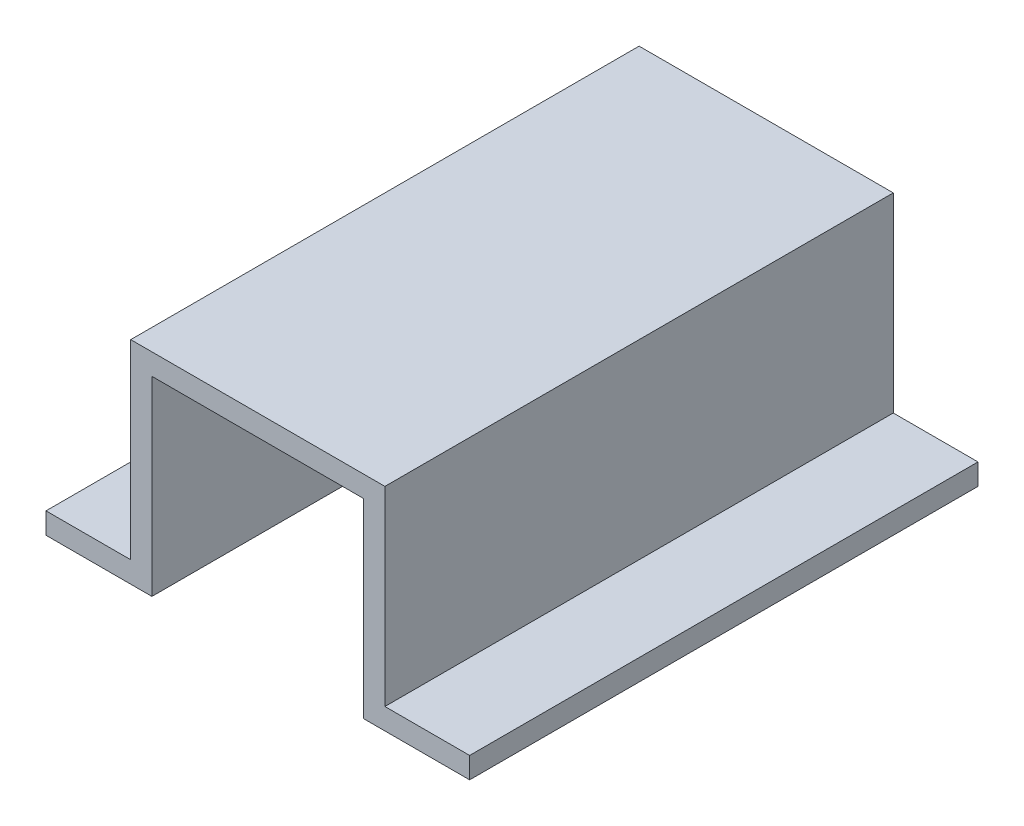
from build123d import *

# Parameters (mm, degrees)
BOSS_EXTRUDE1_DEPTH = 24


with BuildPart() as part:
    # Sketch1 → Boss-Extrude1 (new body)
    with BuildSketch(Plane.XY):
        Polygon((5, 0), (5, 9), (-5, 9), (-5, 0), (-10, 0), (-10, 1), (-6, 1), (-6, 10), (6, 10), (6, 1), (10, 1), (10, 0), align=None)
    extrude(amount=BOSS_EXTRUDE1_DEPTH)


solid = part.part
